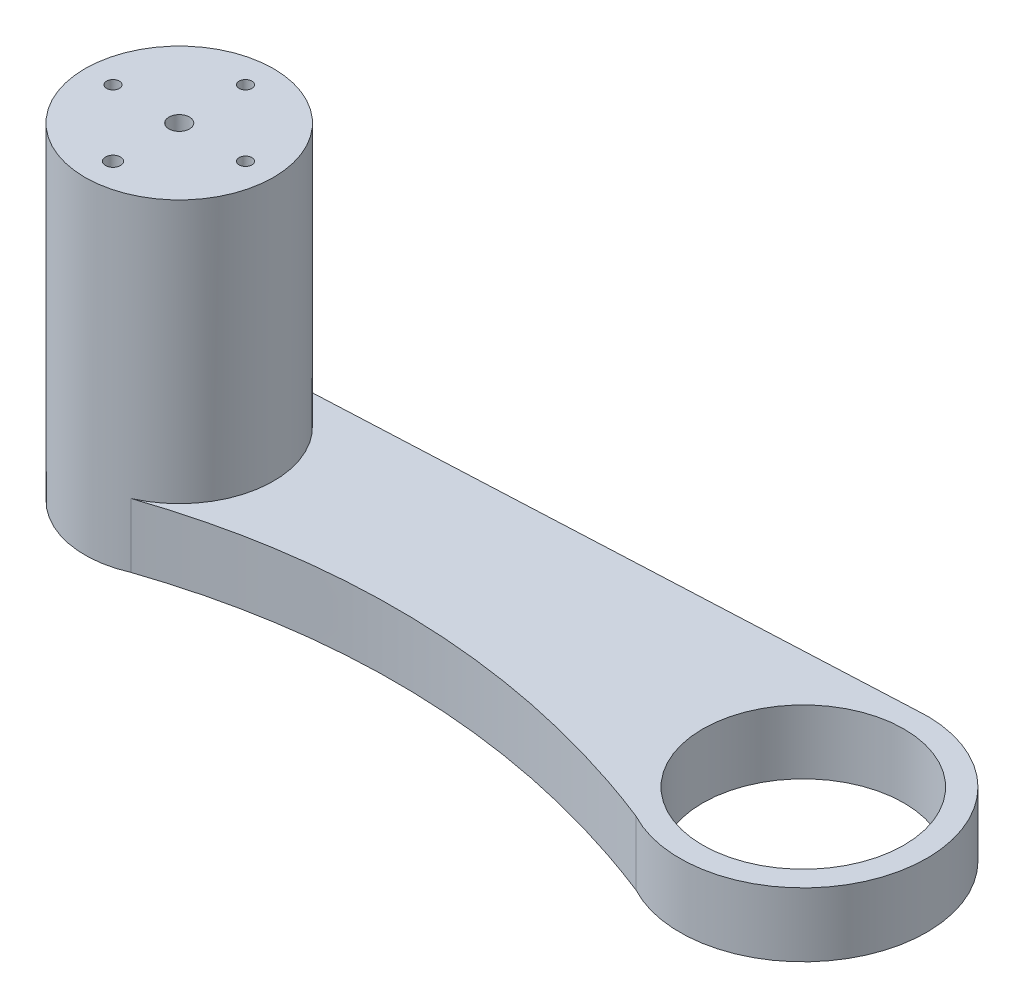
from build123d import *

# Parameters (mm, degrees)
SZKIC1_R                    = 10.3
DODANIE_WYCI_GNI_CIE1_DEPTH = 35.75
OTWORY_USTALAJ_CE_2_5MM2_D  = 2.25
DODANIE_WYCI_GNI_CIE3_START = -7
DODANIE_WYCI_GNI_CIE3_DEPTH = 7
OTWORY_USTALAJ_CE_2_5MM3_D  = 22
SZKIC12_R                   = 0.7
SZKIC12_R_2                 = 0.820346338
WYTNIJ_WYCI_GNI_CIE1_DEPTH  = 7


with BuildPart() as part:
    # Szkic1 → Dodanie-wyciągnięcie1 (new body)
    with BuildSketch(Plane(origin=(0, 0, 0), x_dir=(1, 0, 0), z_dir=(0, 1, 0))):
        with Locations(Location((0, 0, 0), (0, 0, 270))):
            Circle(SZKIC1_R)
    extrude(amount=DODANIE_WYCI_GNI_CIE1_DEPTH)

    # Otwory ustalające Ø2.5mm2 (through all)
    with Locations(Plane.XZ):
        with Locations((0, 0)):
            Hole(OTWORY_USTALAJ_CE_2_5MM2_D / 2)

    # Szkic7 → Dodanie-wyciągnięcie3 (add)
    with BuildSketch(Plane(origin=(0, 35.75, 0), x_dir=(1, 0, 0), z_dir=(0, 1, 0)).offset(DODANIE_WYCI_GNI_CIE3_START)):
        with BuildLine():
            Line((66.943357066, 13.440701035), (0, 10.3))
            ThreePointArc((0, 10.3), (10.077130906, 2.131063748), (4.169904535, -9.418168408))
            add(Edge.make_bspline(
                [(4.169904535, -9.418168408), (22.461776037, -3.24596138), (41.934151815, -4.077243057), (61.820006497, -11.893378905)],
                knots=[0, 0, 0, 0, 1, 1, 1, 1], degree=3))
            ThreePointArc((61.820006497, -11.893378905), (81.439431711, -2.675954354), (66.943357066, 13.440701035))
        make_face()
    extrude(amount=DODANIE_WYCI_GNI_CIE3_DEPTH)

    # Otwory ustalające Ø2.5mm3 (through all)
    with Locations(Plane(origin=(0, 35.75, 0), x_dir=(1, 0, 0), z_dir=(0, 1, 0))):
        with Locations((68.207301561, 0)):
            Hole(OTWORY_USTALAJ_CE_2_5MM3_D / 2)


with BuildPart() as body_2:
    # Lustro1: mirrored copy
    add(part.part.mirror(Plane.ZX))

    # Szkic12 → Wytnij-wyciągnięcie1 (cut)
    with BuildSketch(Plane(origin=(0, 0, 0), x_dir=(1, 0, 0), z_dir=(0, 1, 0))):
        with Locations(Location((0, 7.24, 0), (0, 0, 270))):
            Circle(SZKIC12_R)
        with Locations(Location((0, -7.24, 0), (0, 0, 270))):
            Circle(SZKIC12_R_2)
        with Locations(Location((7.24, 0, 0), (0, 0, 270))):
            Circle(SZKIC12_R)
        with Locations(Location((-7.24, 0, 0), (0, 0, 270))):
            Circle(SZKIC12_R)
    extrude(amount=-WYTNIJ_WYCI_GNI_CIE1_DEPTH, mode=Mode.SUBTRACT)


solid = body_2.part
